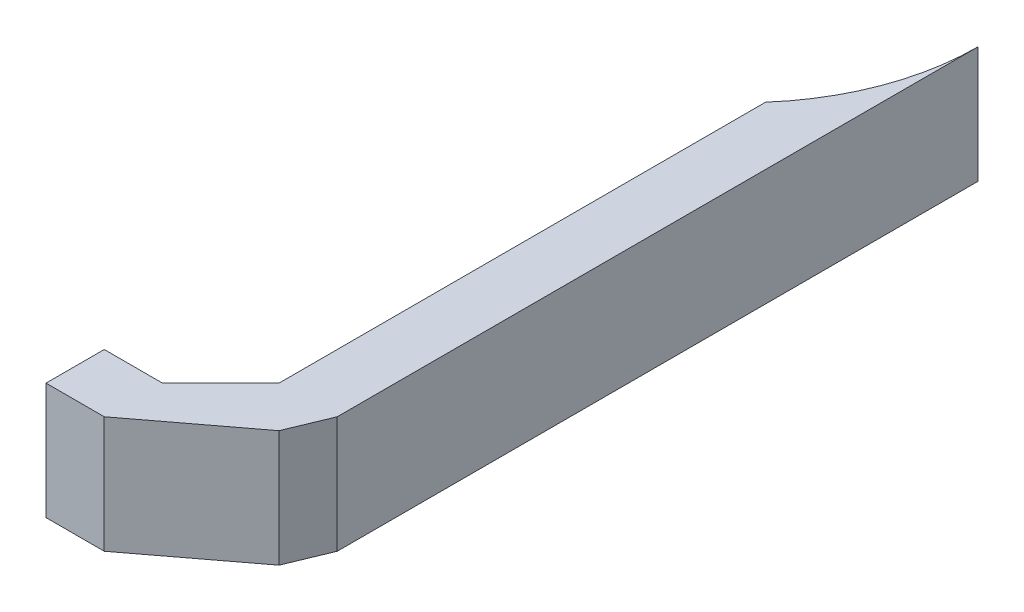
from build123d import *

# Parameters (mm, degrees)
BOSS_EXTRUDE1_DEPTH = 10


with BuildPart() as part:
    # Sketch1 → Boss-Extrude1 (new body)
    with BuildSketch(Plane(origin=(0, 0, 0), x_dir=(1, 0, 0), z_dir=(0, 1, 0))):
        with BuildLine():
            Line((0, 0), (5, 0))
            Line((5, 0), (13.535533906, 6.464466094))
            Line((13.535533906, 6.464466094), (15, 10))
            Line((15, 10), (15, 65))
            ThreePointArc((15, 65), (13.708286934, 57.928932188), (10, 51.771243445))
            Line((10, 51.771243445), (10, 20))
            Line((10, 20), (10, 10))
            Line((10, 10), (5, 5))
            Line((5, 5), (0, 5))
            Line((0, 5), (0, 0))
        make_face()
    extrude(amount=BOSS_EXTRUDE1_DEPTH)


solid = part.part
